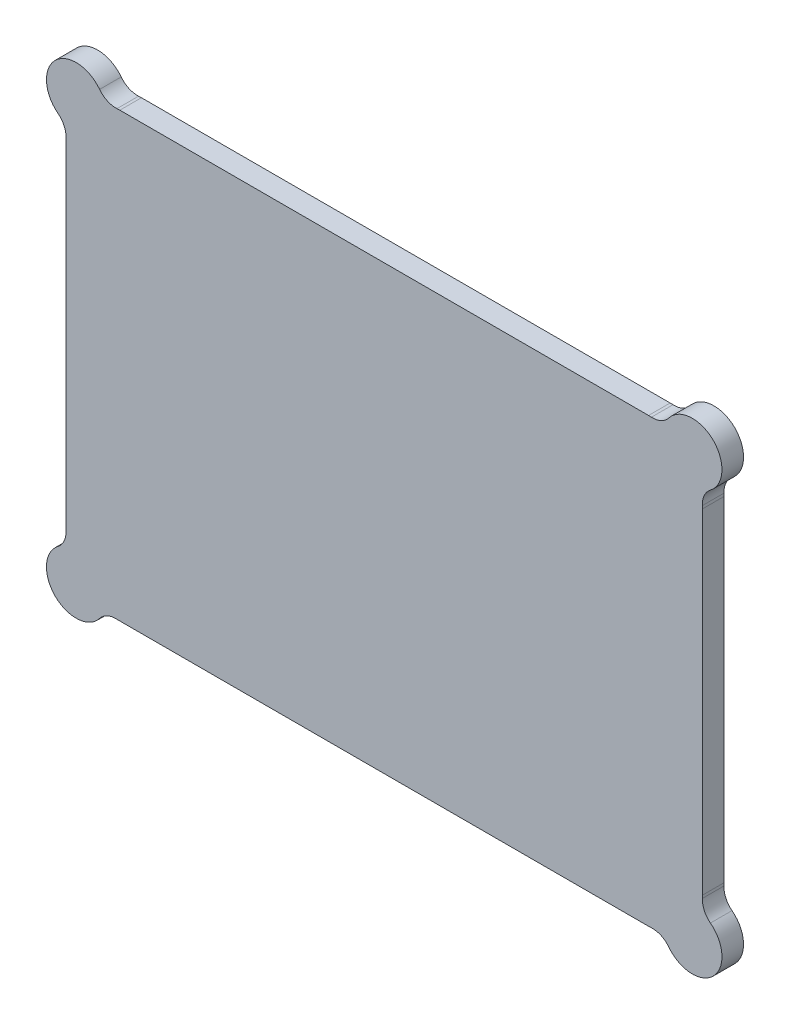
from build123d import *

# Parameters (mm, degrees)
BOSS_EXTRUDE1_DEPTH = 4


with BuildPart() as part:
    # Sketch2 → Boss-Extrude1 (new body)
    with BuildSketch(Plane.XY):
        with BuildLine():
            Line((-59, 31), (-59, -31))
            ThreePointArc((-59, -31), (-58.996474756, -31.265504145), (-58.98590151, -31.530821096))
            ThreePointArc((-58.98590151, -31.530821096), (-59.328144398, -33.323028098), (-60.464454078, -34.750591212))
            ThreePointArc((-60.464454078, -34.750591212), (-60.995689014, -42.995689014), (-52.750591212, -42.464454078))
            ThreePointArc((-52.750591212, -42.464454078), (-51.323028098, -41.328144398), (-49.530821096, -40.98590151))
            ThreePointArc((-49.530821096, -40.98590151), (-49.265504145, -40.996474756), (-49, -41))
            Line((-49, -41), (49, -41))
            ThreePointArc((49, -41), (49.265504145, -40.996474756), (49.530821096, -40.98590151))
            ThreePointArc((49.530821096, -40.98590151), (51.323028098, -41.328144398), (52.750591212, -42.464454078))
            ThreePointArc((52.750591212, -42.464454078), (60.995689014, -42.995689014), (60.464454078, -34.750591212))
            ThreePointArc((60.464454078, -34.750591212), (59.328144398, -33.323028098), (58.98590151, -31.530821096))
            ThreePointArc((58.98590151, -31.530821096), (58.996474756, -31.265504145), (59, -31))
            Line((59, -31), (59, 31))
            ThreePointArc((59, 31), (58.996474756, 31.265504145), (58.98590151, 31.530821096))
            ThreePointArc((58.98590151, 31.530821096), (59.328144398, 33.323028098), (60.464454078, 34.750591212))
            ThreePointArc((60.464454078, 34.750591212), (60.995689014, 42.995689014), (52.750591212, 42.464454078))
            ThreePointArc((52.750591212, 42.464454078), (51.323028098, 41.328144398), (49.530821096, 40.98590151))
            ThreePointArc((49.530821096, 40.98590151), (49.265504145, 40.996474756), (49, 41))
            Line((49, 41), (-49, 41))
            ThreePointArc((-49, 41), (-49.265504145, 40.996474756), (-49.530821096, 40.98590151))
            ThreePointArc((-49.530821096, 40.98590151), (-51.323028098, 41.328144398), (-52.750591212, 42.464454078))
            ThreePointArc((-52.750591212, 42.464454078), (-60.995689014, 42.995689014), (-60.464454078, 34.750591212))
            ThreePointArc((-60.464454078, 34.750591212), (-59.328144398, 33.323028098), (-58.98590151, 31.530821096))
            ThreePointArc((-58.98590151, 31.530821096), (-58.996474756, 31.265504145), (-59, 31))
        make_face()
    extrude(amount=BOSS_EXTRUDE1_DEPTH)


solid = part.part
